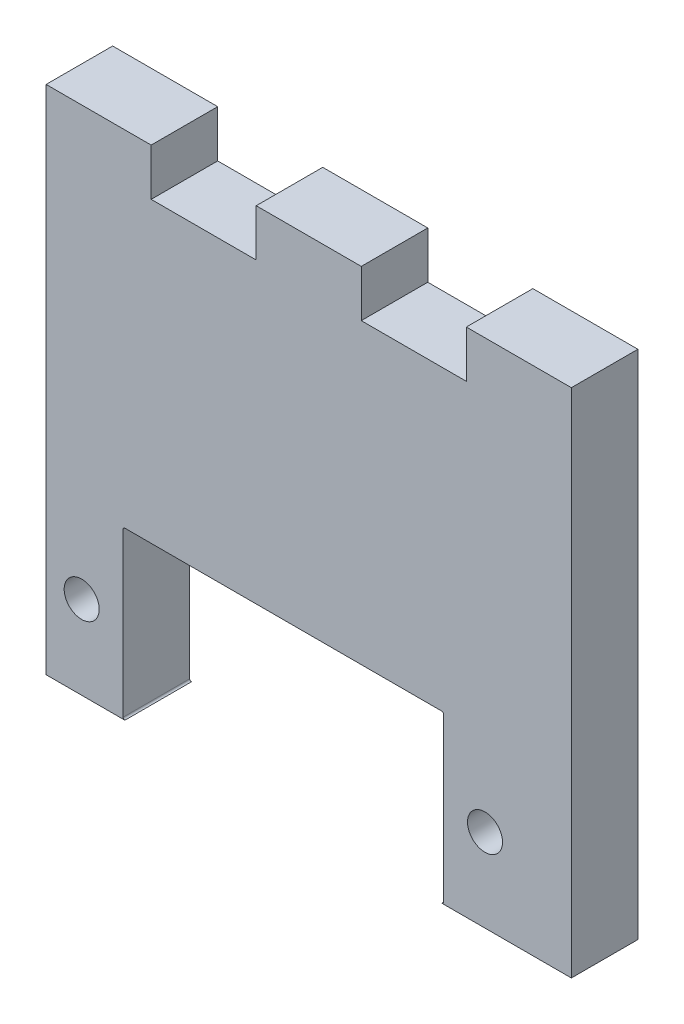
from build123d import *

# Parameters (mm, degrees)
SKETCH1_W           = 38.1
SKETCH1_H           = 37.084
BOSS_EXTRUDE1_DEPTH = 4.826
SKETCH3_R           = 1.27
CUT_EXTRUDE2_DEPTH  = 54.386546358
CUT_EXTRUDE3_DEPTH  = 54.386546358
SKETCH5_W           = 7.62
SKETCH5_H           = 3.409901171
CUT_EXTRUDE4_DEPTH  = 54.386546358


with BuildPart() as part:
    # Sketch1 → Boss-Extrude1 (new body)
    with BuildSketch(Plane.XY):
        with Locations((19.05, 18.542)):
            Rectangle(SKETCH1_W, SKETCH1_H)
    extrude(amount=BOSS_EXTRUDE1_DEPTH)

    # Sketch3 → Cut-Extrude2 (cut, through all)
    with BuildSketch(Plane.XY.offset(4.826)):
        with Locations((2.580480538, 6.0325)):
            Circle(SKETCH3_R)
        with Locations((31.836519462, 6.0325)):
            Circle(SKETCH3_R)
    extrude(amount=-CUT_EXTRUDE2_DEPTH, mode=Mode.SUBTRACT)

    # Sketch4 → Cut-Extrude3 (cut, through all)
    with BuildSketch(Plane(origin=(0, 0, 0), x_dir=(-1, 0, 0), z_dir=(0, 0, -1))):
        with BuildLine():
            Line((-28.702, 12.065), (-5.715, 12.065))
            ThreePointArc((-5.715, 12.065), (-5.625197439, 12.027802561), (-5.588, 11.938))
            Line((-5.588, 11.938), (-5.588, 0.127))
            ThreePointArc((-5.588, 0.127), (-5.625197439, 0.037197439), (-5.715, 0))
            Line((-5.715, 0), (-28.702, 0))
            ThreePointArc((-28.702, 0), (-28.791802561, 0.037197439), (-28.829, 0.127))
            Line((-28.829, 0.127), (-28.829, 11.938))
            ThreePointArc((-28.829, 11.938), (-28.791802561, 12.027802561), (-28.702, 12.065))
        make_face()
    extrude(amount=-CUT_EXTRUDE3_DEPTH, mode=Mode.SUBTRACT)

    # Sketch5 → Cut-Extrude4 (cut, through all)
    with BuildSketch(Plane.XY.offset(4.826)):
        with Locations((11.43, 35.379049415)):
            Rectangle(SKETCH5_W, SKETCH5_H)
        with Locations((26.67, 35.379049415)):
            Rectangle(SKETCH5_W, SKETCH5_H)
    extrude(amount=-CUT_EXTRUDE4_DEPTH, mode=Mode.SUBTRACT)


solid = part.part
